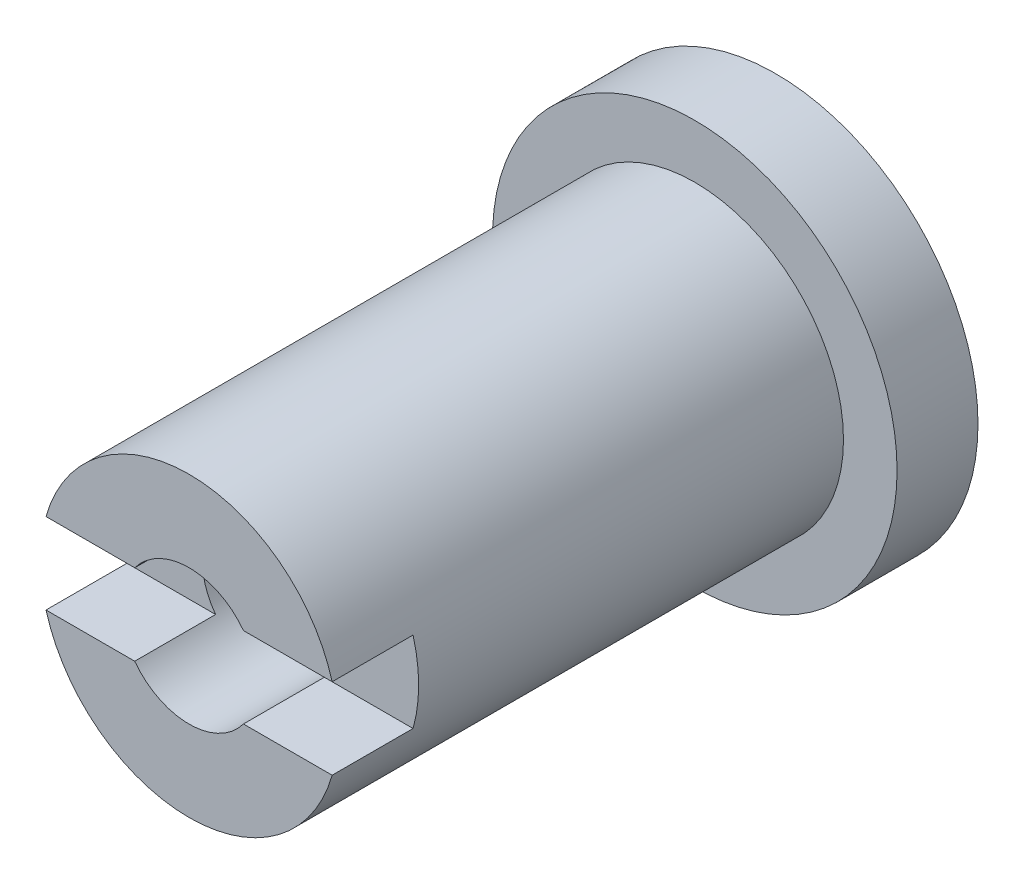
from build123d import *

# Parameters (mm, degrees)
SKETCH_1_R          = 10
SKETCH_1_R_2        = 4
EXTRUDE_1_DEPTH     = 4
SKETCH_2_R          = 7.35
SKETCH_2_R_2        = 3.35
EXTRUDE_2_DEPTH     = 25
SKETCH_3_W          = 15.774529682
SKETCH_3_H          = 4
CUT_EXTRUDE_1_DEPTH = 4


with BuildPart() as part:
    # 草图1 → 拉伸-薄壁1 (new body)
    with BuildSketch(Plane.XY):
        Circle(SKETCH_1_R)
        Circle(SKETCH_1_R_2, mode=Mode.SUBTRACT)
    extrude(amount=EXTRUDE_1_DEPTH)

    # 草图2 → 拉伸-薄壁2 (add)
    with BuildSketch(Plane.XY.offset(4)):
        Circle(SKETCH_2_R)
        Circle(SKETCH_2_R_2, mode=Mode.SUBTRACT)
    extrude(amount=EXTRUDE_2_DEPTH)

    # 草图3 → 切除-拉伸1 (cut)
    with BuildSketch(Plane.XY.offset(29)):
        Rectangle(SKETCH_3_W, SKETCH_3_H)
    extrude(amount=-CUT_EXTRUDE_1_DEPTH, mode=Mode.SUBTRACT)


solid = part.part
